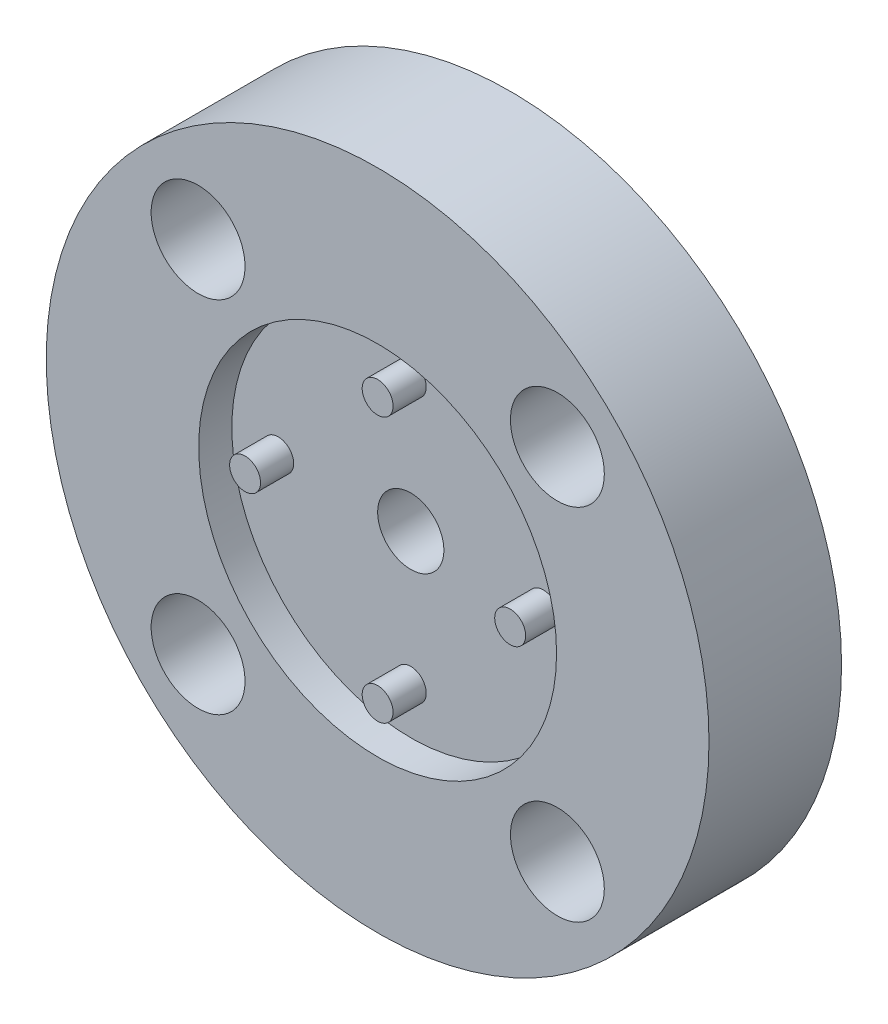
from build123d import *

# Parameters (mm, degrees)
SKETCH1_R           = 15
SKETCH1_R_2         = 2.125
SKETCH1_R_3         = 1.5
BOSS_EXTRUDE1_DEPTH = 6
SKETCH2_R           = 8.1
SKETCH2_R_2         = 0.7
CUT_EXTRUDE1_DEPTH  = 1.5
SKETCH3_R           = 3
CUT_EXTRUDE2_DEPTH  = 2


with BuildPart() as part:
    # Sketch1 → Boss-Extrude1 (new body)
    with BuildSketch(Plane.XY):
        Circle(SKETCH1_R)
        with Locations((8.136527837, 8.126925295)):
            Circle(SKETCH1_R_2, mode=Mode.SUBTRACT)
        with Locations((8.136527837, -8.136530672)):
            Circle(SKETCH1_R_2, mode=Mode.SUBTRACT)
        with Locations((-8.12692813, -8.136530672)):
            Circle(SKETCH1_R_2, mode=Mode.SUBTRACT)
        with Locations((-8.12692813, 8.126925295)):
            Circle(SKETCH1_R_2, mode=Mode.SUBTRACT)
        Circle(SKETCH1_R_3, mode=Mode.SUBTRACT)
    extrude(amount=BOSS_EXTRUDE1_DEPTH)

    # Sketch2 → Cut-Extrude1 (cut)
    with BuildSketch(Plane.XY.offset(6)):
        Circle(SKETCH2_R)
        with Locations((0, 6)):
            Circle(SKETCH2_R_2, mode=Mode.SUBTRACT)
        with Locations((6, 0)):
            Circle(SKETCH2_R_2, mode=Mode.SUBTRACT)
        with Locations((0, -6)):
            Circle(SKETCH2_R_2, mode=Mode.SUBTRACT)
        with Locations((-6, 0)):
            Circle(SKETCH2_R_2, mode=Mode.SUBTRACT)
    extrude(amount=-CUT_EXTRUDE1_DEPTH, mode=Mode.SUBTRACT)

    # Sketch3 → Cut-Extrude2 (cut)
    with BuildSketch(Plane(origin=(0, 0, 0), x_dir=(-1, 0, 0), z_dir=(0, 0, -1))):
        Circle(SKETCH3_R)
    extrude(amount=-CUT_EXTRUDE2_DEPTH, mode=Mode.SUBTRACT)


solid = part.part
